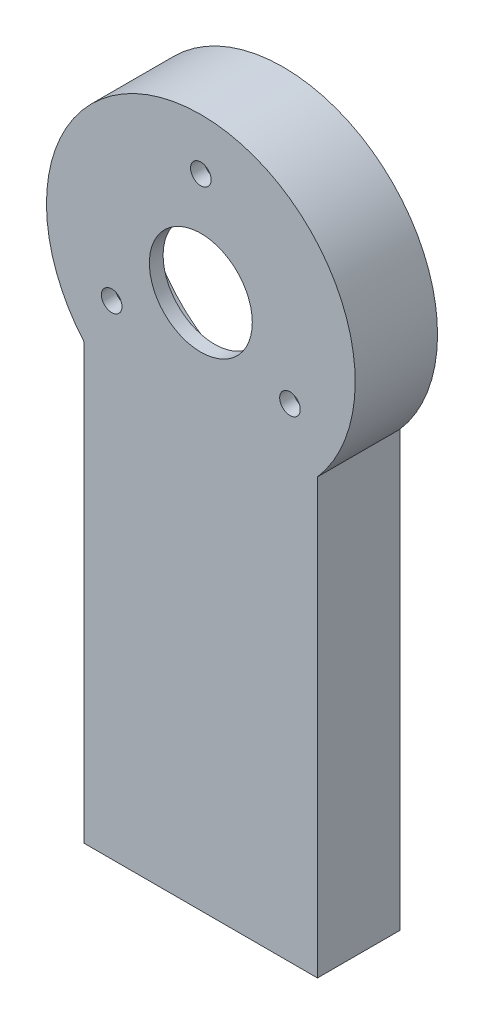
from build123d import *

# Parameters (mm, degrees)
SKETCH1_R           = 22.5
BOSS_EXTRUDE1_DEPTH = 12
SKETCH2_R           = 21
CUT_EXTRUDE1_DEPTH  = 10
SKETCH3_R           = 1.5
SKETCH3_R_2         = 7.5
CUT_EXTRUDE2_DEPTH  = 83.0624762


with BuildPart() as part:
    # Sketch1 → Boss-Extrude1 (new body)
    with BuildSketch(Plane.XY):
        Circle(SKETCH1_R)
        with BuildLine():
            Line((-17, -14.739402973), (-17, -78))
            Line((-17, -78), (17, -78))
            Line((17, -78), (17, -14.739402973))
            ThreePointArc((17, -14.739402973), (0, -22.5), (-17, -14.739402973))
        make_face()
    extrude(amount=BOSS_EXTRUDE1_DEPTH)

    # Sketch2 → Cut-Extrude1 (cut)
    with BuildSketch(Plane(origin=(0, 0, 0), x_dir=(-1, 0, 0), z_dir=(0, 0, -1))):
        Circle(SKETCH2_R)
    extrude(amount=-CUT_EXTRUDE1_DEPTH, mode=Mode.SUBTRACT)

    # Sketch3 → Cut-Extrude2 (cut, through all)
    with BuildSketch(Plane.XY.offset(12)):
        with Locations((0, 15)):
            Circle(SKETCH3_R)
        with Locations((12.990381057, -7.5)):
            Circle(SKETCH3_R)
        with Locations((-12.990381057, -7.5)):
            Circle(SKETCH3_R)
        Circle(SKETCH3_R_2)
    extrude(amount=-CUT_EXTRUDE2_DEPTH, mode=Mode.SUBTRACT)


solid = part.part
